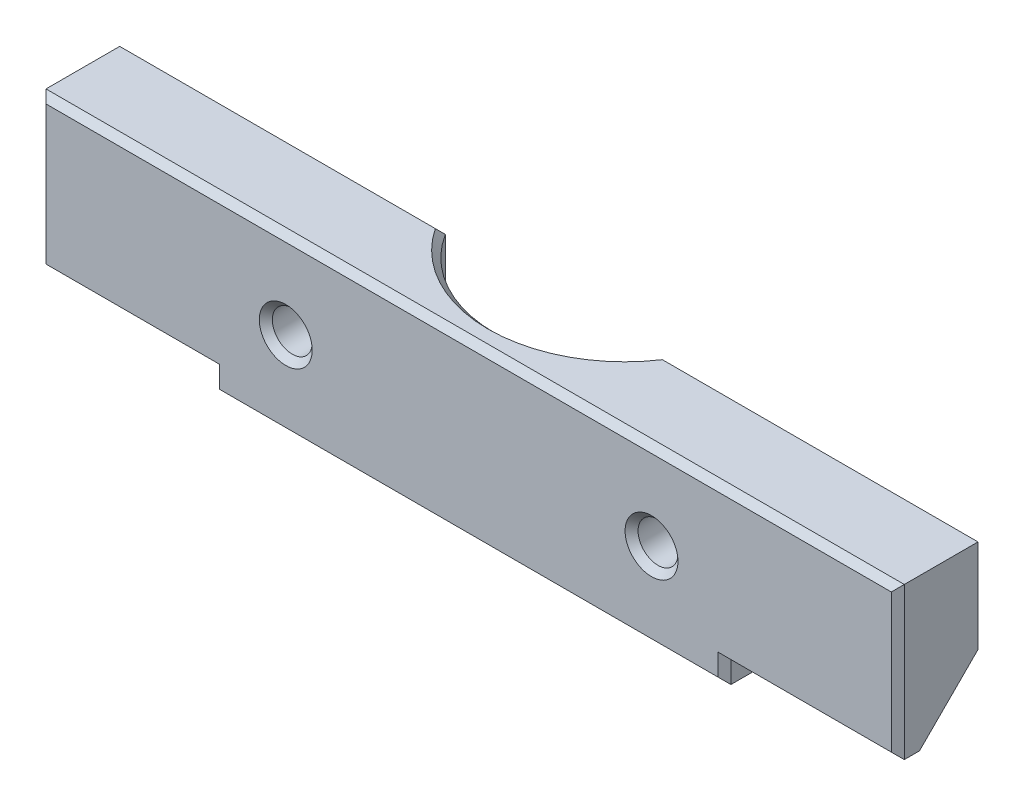
from build123d import *

# Parameters (mm, degrees)
SKIZZE1_W                       = 59
SKIZZE1_H                       = 20
AUFSATZ_LINEAR_AUSTRAGEN1_DEPTH = 10
AUFSATZ_LINEAR_AUSTRAGEN2_DEPTH = 20
SKIZZE3_R                       = 15
SCHNITT_LINEAR_AUSTRAGEN1_DEPTH = 20
SKIZZE4_R                       = 2.3
SCHNITT_LINEAR_AUSTRAGEN2_DEPTH = 20
SKIZZE5_R                       = 3.75
SCHNITT_LINEAR_AUSTRAGEN3_DEPTH = 3
SCHNITT_LINEAR_AUSTRAGEN4_DEPTH = 20
FASE3_SIZE                      = 0.75


with BuildPart() as part:
    # Skizze1 → Aufsatz-Linear austragen1 (new body)
    with BuildSketch(Plane.XY):
        with Locations((0, 10)):
            Rectangle(SKIZZE1_W, SKIZZE1_H)
    extrude(amount=AUFSATZ_LINEAR_AUSTRAGEN1_DEPTH)

    # Skizze2 → Aufsatz-Linear austragen2 (add)
    with BuildSketch(Plane.ZY.offset(29.5)):
        Polygon((10, 0), (0, 10), (0, 20), (10, 20), align=None)
    aufsatz_linear_austragen2 = extrude(amount=AUFSATZ_LINEAR_AUSTRAGEN2_DEPTH)

    # Spiegeln1: Aufsatz-Linear austragen2 across plane
    add(aufsatz_linear_austragen2.mirror(Plane(origin=(0, 0, 0), x_dir=(0, 0, 1), z_dir=(1, 0, 0))))

    # Skizze3 → Schnitt-Linear austragen1 (cut)
    with BuildSketch(Plane.XZ):
        with Locations((0, -8)):
            Circle(SKIZZE3_R)
    extrude(amount=-SCHNITT_LINEAR_AUSTRAGEN1_DEPTH, mode=Mode.SUBTRACT)

    # Skizze4 → Schnitt-Linear austragen2 (cut)
    with BuildSketch(Plane(origin=(0, 0, 0), x_dir=(-1, 0, 0), z_dir=(0, 0, -1))):
        with Locations((-21.09428877, 10)):
            Circle(SKIZZE4_R)
        with Locations(Location((21.09428877, 10, 0), (0, 0, 180))):
            Circle(SKIZZE4_R)
    extrude(amount=-SCHNITT_LINEAR_AUSTRAGEN2_DEPTH, mode=Mode.SUBTRACT)

    # Skizze5 → Schnitt-Linear austragen3 (cut)
    with BuildSketch(Plane(origin=(0, 0, 0), x_dir=(-1, 0, 0), z_dir=(0, 0, -1))):
        with Locations((-21.09428877, 10)):
            Circle(SKIZZE5_R)
        with Locations((21.09428877, 10)):
            Circle(SKIZZE5_R)
    extrude(amount=-SCHNITT_LINEAR_AUSTRAGEN3_DEPTH, mode=Mode.SUBTRACT)

    # Skizze6 → Schnitt-Linear austragen4 (cut)
    with BuildSketch(Plane.ZY.offset(49.5)):
        Polygon((10, 2.5), (4.852604626, 2.5), (4.852604626, -2.668604054), (13.586779437, -2.788104879), (13.586779437, 2.151024835), align=None)
    schnitt_linear_austragen4 = extrude(amount=-SCHNITT_LINEAR_AUSTRAGEN4_DEPTH, mode=Mode.SUBTRACT)

    # Spiegeln3: Schnitt-Linear austragen4 across plane
    add(schnitt_linear_austragen4.mirror(Plane(origin=(0, 0, 0), x_dir=(0, 0, 1), z_dir=(1, 0, 0))), mode=Mode.SUBTRACT)

    # Fase3
    fase3_edges = [part.edges().sort_by_distance(p)[0] for p in [
        (39.5, 2.5, 10),
        (29.5, 1.25, 10),
        (0, 0, 10),
        (-29.5, 5, 0),
        (-49.5, 15, 0),
        (49.5, 15, 0),
        (-31.09428877, 20, 0),
        (21.09428877, 0, 0),
        (0, 20, 7),
        (0, 0, 7),
        (0, 20, 10),
        (29.5, 5, 0),
        (23.39428877, 10, 10),
        (-21.09428877, 0, 0),
        (-23.39428877, 10, 10),
        (31.09428877, 20, 0),
        (24.84428877, 10, 0),
        (-17.34428877, 10, 0),
        (-49.5, 11.25, 10),
        (-39.5, 2.5, 10),
        (-29.5, 1.25, 10),
        (49.5, 11.25, 10),
    ]]
    chamfer(fase3_edges, length=FASE3_SIZE)


solid = part.part
